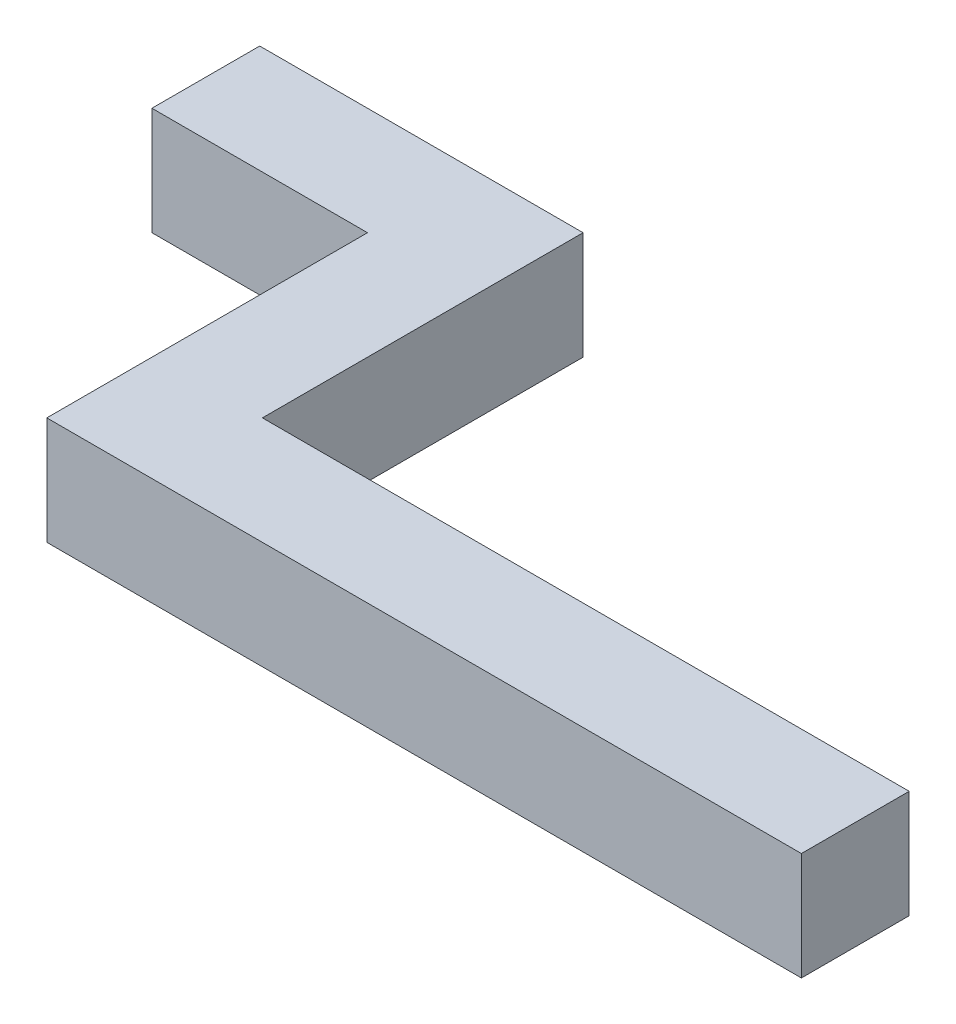
from build123d import *

# Parameters (mm, degrees)
BOSS_EXTRUDE1_DEPTH = 20


with BuildPart() as part:
    # Sketch1 → Boss-Extrude1 (new body)
    with BuildSketch(Plane(origin=(0, 0, 0), x_dir=(1, 0, 0), z_dir=(0, 1, 0))):
        Polygon((0, 0), (60, 0), (60, -59.5), (180, -59.5), (180, -79.5), (126.937455238, -79.5), (40, -79.5), (40, -20), (0, -20), align=None)
    extrude(amount=BOSS_EXTRUDE1_DEPTH)


solid = part.part
